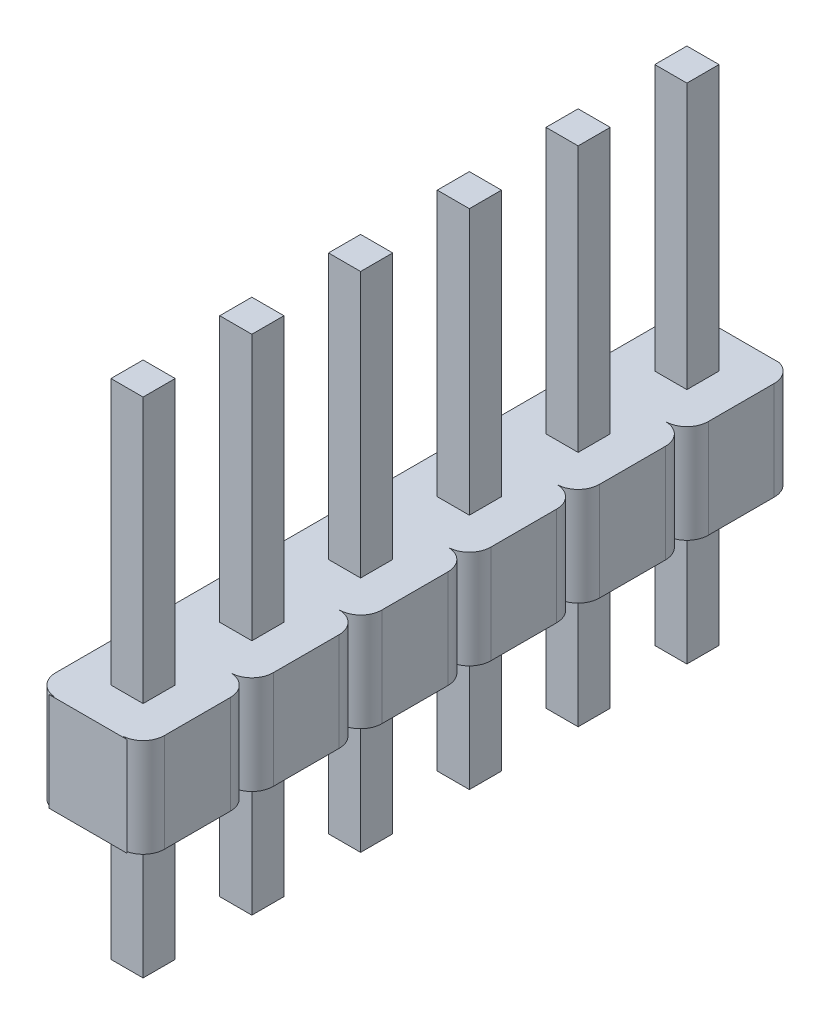
from build123d import *

# Parameters (mm, degrees)
CROQUIS1_W               = 2.54
CROQUIS1_H               = 15.24
SALIENTE_EXTRUIR1_DEPTH  = 2.3
CORTAR_EXTRUIR4_DEPTH    = 2.3
CORTAR_EXTRUIR5_DEPTH    = 2.3
CORTAR_EXTRUIR6_DEPTH    = 2.3
CORTAR_EXTRUIR7_DEPTH    = 2.3
CORTAR_EXTRUIR8_DEPTH    = 2.3
CORTAR_EXTRUIR9_DEPTH    = 2.3
CORTAR_EXTRUIR10_DEPTH   = 2.3
CORTAR_EXTRUIR13_DEPTH   = 2.3
CORTAR_EXTRUIR14_DEPTH   = 2.3
CORTAR_EXTRUIR15_DEPTH   = 2.3
CORTAR_EXTRUIR16_DEPTH   = 2.3
CORTAR_EXTRUIR17_DEPTH   = 2.3
CORTAR_EXTRUIR18_DEPTH   = 2.3
CORTAR_EXTRUIR19_DEPTH   = 2.3
CROQUIS27_W              = 0.75
CROQUIS27_H              = 0.75
SALIENTE_EXTRUIR5_DEPTH  = 6.2
CROQUIS28_W              = 0.75
CROQUIS28_H              = 0.75
SALIENTE_EXTRUIR6_DEPTH  = 6.2
CROQUIS29_W              = 0.75
CROQUIS29_H              = 0.75
SALIENTE_EXTRUIR7_DEPTH  = 6.2
CROQUIS30_W              = 0.75
CROQUIS30_H              = 0.75
SALIENTE_EXTRUIR8_DEPTH  = 6.2
CROQUIS31_W              = 0.75
CROQUIS31_H              = 0.75
SALIENTE_EXTRUIR9_DEPTH  = 6.2
CROQUIS32_W              = 0.75
CROQUIS32_H              = 0.75
SALIENTE_EXTRUIR10_DEPTH = 6.2
CROQUIS38_W              = 0.75
CROQUIS38_H              = 0.75
SALIENTE_EXTRUIR16_DEPTH = 3.25
CROQUIS39_W              = 0.75
CROQUIS39_H              = 0.75
SALIENTE_EXTRUIR17_DEPTH = 3.25
CROQUIS40_W              = 0.75
CROQUIS40_H              = 0.75
SALIENTE_EXTRUIR18_DEPTH = 3.25
CROQUIS41_W              = 0.75
CROQUIS41_H              = 0.75
SALIENTE_EXTRUIR19_DEPTH = 3.25
CROQUIS42_W              = 0.75
CROQUIS42_H              = 0.75
SALIENTE_EXTRUIR20_DEPTH = 3.25
CROQUIS43_W              = 0.75
CROQUIS43_H              = 0.75
SALIENTE_EXTRUIR21_DEPTH = 3.25


with BuildPart() as part:
    # Croquis1 → Saliente-Extruir1 (new body)
    with BuildSketch(Plane(origin=(0, 2.3, 0), x_dir=(1, 0, 0), z_dir=(0, 1, 0))):
        with Locations((0, -11.45)):
            Rectangle(CROQUIS1_W, CROQUIS1_H)
    extrude(amount=-SALIENTE_EXTRUIR1_DEPTH)

    # Croquis5 → Cortar-Extruir4 (cut)
    with BuildSketch(Plane.XZ):
        with BuildLine():
            Line((1.27, 18.55), (1.27, 19.55))
            ThreePointArc((1.27, 19.55), (1.123553391, 19.196446609), (0.77, 19.05))
            ThreePointArc((0.77, 19.05), (1.123553391, 18.903553391), (1.27, 18.55))
        make_face()
    extrude(amount=-CORTAR_EXTRUIR4_DEPTH, mode=Mode.SUBTRACT)

    # Croquis6 → Cortar-Extruir5 (cut)
    with BuildSketch(Plane.XZ):
        with BuildLine():
            Line((1.27, 16.01), (1.27, 17.01))
            ThreePointArc((1.27, 17.01), (1.123553391, 16.656446609), (0.77, 16.51))
            ThreePointArc((0.77, 16.51), (1.123553391, 16.363553391), (1.27, 16.01))
        make_face()
    extrude(amount=-CORTAR_EXTRUIR5_DEPTH, mode=Mode.SUBTRACT)

    # Croquis7 → Cortar-Extruir6 (cut)
    with BuildSketch(Plane.XZ):
        with BuildLine():
            Line((1.27, 13.47), (1.27, 14.47))
            ThreePointArc((1.27, 14.47), (1.123553391, 14.116446609), (0.77, 13.97))
            ThreePointArc((0.77, 13.97), (1.123553391, 13.823553391), (1.27, 13.47))
        make_face()
    extrude(amount=-CORTAR_EXTRUIR6_DEPTH, mode=Mode.SUBTRACT)

    # Croquis8 → Cortar-Extruir7 (cut)
    with BuildSketch(Plane.XZ):
        with BuildLine():
            Line((1.27, 10.93), (1.27, 11.93))
            ThreePointArc((1.27, 11.93), (1.123553391, 11.576446609), (0.77, 11.43))
            ThreePointArc((0.77, 11.43), (1.123553391, 11.283553391), (1.27, 10.93))
        make_face()
    extrude(amount=-CORTAR_EXTRUIR7_DEPTH, mode=Mode.SUBTRACT)

    # Croquis9 → Cortar-Extruir8 (cut)
    with BuildSketch(Plane.XZ):
        with BuildLine():
            Line((1.27, 8.39), (1.27, 9.39))
            ThreePointArc((1.27, 9.39), (1.123553391, 9.036446609), (0.77, 8.89))
            ThreePointArc((0.77, 8.89), (1.123553391, 8.743553391), (1.27, 8.39))
        make_face()
    extrude(amount=-CORTAR_EXTRUIR8_DEPTH, mode=Mode.SUBTRACT)

    # Croquis10 → Cortar-Extruir9 (cut)
    with BuildSketch(Plane.XZ):
        with BuildLine():
            Line((1.27, 5.85), (1.27, 6.85))
            ThreePointArc((1.27, 6.85), (1.123553391, 6.496446609), (0.77, 6.35))
            ThreePointArc((0.77, 6.35), (1.123553391, 6.203553391), (1.27, 5.85))
        make_face()
    extrude(amount=-CORTAR_EXTRUIR9_DEPTH, mode=Mode.SUBTRACT)

    # Croquis11 → Cortar-Extruir10 (cut)
    with BuildSketch(Plane.XZ):
        with BuildLine():
            Line((1.27, 3.31), (1.27, 4.31))
            ThreePointArc((1.27, 4.31), (1.123553391, 3.956446609), (0.77, 3.81))
            ThreePointArc((0.77, 3.81), (1.123553391, 3.663553391), (1.27, 3.31))
        make_face()
    extrude(amount=-CORTAR_EXTRUIR10_DEPTH, mode=Mode.SUBTRACT)

    # Croquis14 → Cortar-Extruir13 (cut)
    with BuildSketch(Plane.XZ):
        with BuildLine():
            Line((-1.27, 4.31), (-1.27, 3.31))
            ThreePointArc((-1.27, 3.31), (-1.123553391, 3.663553391), (-0.77, 3.81))
            ThreePointArc((-0.77, 3.81), (-1.123553391, 3.956446609), (-1.27, 4.31))
        make_face()
    extrude(amount=-CORTAR_EXTRUIR13_DEPTH, mode=Mode.SUBTRACT)

    # Croquis15 → Cortar-Extruir14 (cut)
    with BuildSketch(Plane.XZ):
        with BuildLine():
            Line((-1.27, 6.85), (-1.27, 5.85))
            ThreePointArc((-1.27, 5.85), (-1.123553391, 6.203553391), (-0.77, 6.35))
            ThreePointArc((-0.77, 6.35), (-1.123553391, 6.496446609), (-1.27, 6.85))
        make_face()
    extrude(amount=-CORTAR_EXTRUIR14_DEPTH, mode=Mode.SUBTRACT)

    # Croquis16 → Cortar-Extruir15 (cut)
    with BuildSketch(Plane.XZ):
        with BuildLine():
            Line((-1.27, 9.39), (-1.27, 8.39))
            ThreePointArc((-1.27, 8.39), (-1.123553391, 8.743553391), (-0.77, 8.89))
            ThreePointArc((-0.77, 8.89), (-1.123553391, 9.036446609), (-1.27, 9.39))
        make_face()
    extrude(amount=-CORTAR_EXTRUIR15_DEPTH, mode=Mode.SUBTRACT)

    # Croquis17 → Cortar-Extruir16 (cut)
    with BuildSketch(Plane.XZ):
        with BuildLine():
            Line((-1.27, 11.93), (-1.27, 10.93))
            ThreePointArc((-1.27, 10.93), (-1.123553391, 11.283553391), (-0.77, 11.43))
            ThreePointArc((-0.77, 11.43), (-1.123553391, 11.576446609), (-1.27, 11.93))
        make_face()
    extrude(amount=-CORTAR_EXTRUIR16_DEPTH, mode=Mode.SUBTRACT)

    # Croquis18 → Cortar-Extruir17 (cut)
    with BuildSketch(Plane.XZ):
        with BuildLine():
            Line((-1.27, 14.47), (-1.27, 13.47))
            ThreePointArc((-1.27, 13.47), (-1.123553391, 13.823553391), (-0.77, 13.97))
            ThreePointArc((-0.77, 13.97), (-1.123553391, 14.116446609), (-1.27, 14.47))
        make_face()
    extrude(amount=-CORTAR_EXTRUIR17_DEPTH, mode=Mode.SUBTRACT)

    # Croquis19 → Cortar-Extruir18 (cut)
    with BuildSketch(Plane.XZ):
        with BuildLine():
            Line((-1.27, 17.01), (-1.27, 16.01))
            ThreePointArc((-1.27, 16.01), (-1.123553391, 16.363553391), (-0.77, 16.51))
            ThreePointArc((-0.77, 16.51), (-1.123553391, 16.656446609), (-1.27, 17.01))
        make_face()
    extrude(amount=-CORTAR_EXTRUIR18_DEPTH, mode=Mode.SUBTRACT)

    # Croquis20 → Cortar-Extruir19 (cut)
    with BuildSketch(Plane.XZ):
        with BuildLine():
            Line((-1.27, 19.55), (-1.27, 18.55))
            ThreePointArc((-1.27, 18.55), (-1.123553391, 18.903553391), (-0.77, 19.05))
            ThreePointArc((-0.77, 19.05), (-1.123553391, 19.196446609), (-1.27, 19.55))
        make_face()
    extrude(amount=-CORTAR_EXTRUIR19_DEPTH, mode=Mode.SUBTRACT)

    # Croquis27 → Saliente-Extruir5 (add)
    with BuildSketch(Plane(origin=(0, 2.3, 0), x_dir=(-1, 0, 0), z_dir=(0, 1, 0))):
        with Locations((0, 5.08)):
            Rectangle(CROQUIS27_W, CROQUIS27_H)
    extrude(amount=SALIENTE_EXTRUIR5_DEPTH)

    # Croquis28 → Saliente-Extruir6 (add)
    with BuildSketch(Plane(origin=(0, 2.3, 0), x_dir=(-1, 0, 0), z_dir=(0, 1, 0))):
        with Locations((0, 7.62)):
            Rectangle(CROQUIS28_W, CROQUIS28_H)
    extrude(amount=SALIENTE_EXTRUIR6_DEPTH)

    # Croquis29 → Saliente-Extruir7 (add)
    with BuildSketch(Plane(origin=(0, 2.3, 0), x_dir=(-1, 0, 0), z_dir=(0, 1, 0))):
        with Locations((0, 10.16)):
            Rectangle(CROQUIS29_W, CROQUIS29_H)
    extrude(amount=SALIENTE_EXTRUIR7_DEPTH)

    # Croquis30 → Saliente-Extruir8 (add)
    with BuildSketch(Plane(origin=(0, 2.3, 0), x_dir=(-1, 0, 0), z_dir=(0, 1, 0))):
        with Locations((0, 12.7)):
            Rectangle(CROQUIS30_W, CROQUIS30_H)
    extrude(amount=SALIENTE_EXTRUIR8_DEPTH)

    # Croquis31 → Saliente-Extruir9 (add)
    with BuildSketch(Plane(origin=(0, 2.3, 0), x_dir=(-1, 0, 0), z_dir=(0, 1, 0))):
        with Locations((0, 15.24)):
            Rectangle(CROQUIS31_W, CROQUIS31_H)
    extrude(amount=SALIENTE_EXTRUIR9_DEPTH)

    # Croquis32 → Saliente-Extruir10 (add)
    with BuildSketch(Plane(origin=(0, 2.3, 0), x_dir=(-1, 0, 0), z_dir=(0, 1, 0))):
        with Locations((0, 17.78)):
            Rectangle(CROQUIS32_W, CROQUIS32_H)
    extrude(amount=SALIENTE_EXTRUIR10_DEPTH)

    # Croquis38 → Saliente-Extruir16 (add)
    with BuildSketch(Plane.XZ):
        with Locations((0, 5.08)):
            Rectangle(CROQUIS38_W, CROQUIS38_H)
    extrude(amount=SALIENTE_EXTRUIR16_DEPTH)

    # Croquis39 → Saliente-Extruir17 (add)
    with BuildSketch(Plane.XZ):
        with Locations((0, 7.62)):
            Rectangle(CROQUIS39_W, CROQUIS39_H)
    extrude(amount=SALIENTE_EXTRUIR17_DEPTH)

    # Croquis40 → Saliente-Extruir18 (add)
    with BuildSketch(Plane.XZ):
        with Locations((0, 10.16)):
            Rectangle(CROQUIS40_W, CROQUIS40_H)
    extrude(amount=SALIENTE_EXTRUIR18_DEPTH)

    # Croquis41 → Saliente-Extruir19 (add)
    with BuildSketch(Plane.XZ):
        with Locations((0, 12.7)):
            Rectangle(CROQUIS41_W, CROQUIS41_H)
    extrude(amount=SALIENTE_EXTRUIR19_DEPTH)

    # Croquis42 → Saliente-Extruir20 (add)
    with BuildSketch(Plane.XZ):
        with Locations((0, 15.24)):
            Rectangle(CROQUIS42_W, CROQUIS42_H)
    extrude(amount=SALIENTE_EXTRUIR20_DEPTH)

    # Croquis43 → Saliente-Extruir21 (add)
    with BuildSketch(Plane.XZ):
        with Locations((0, 17.78)):
            Rectangle(CROQUIS43_W, CROQUIS43_H)
    extrude(amount=SALIENTE_EXTRUIR21_DEPTH)


solid = part.part
